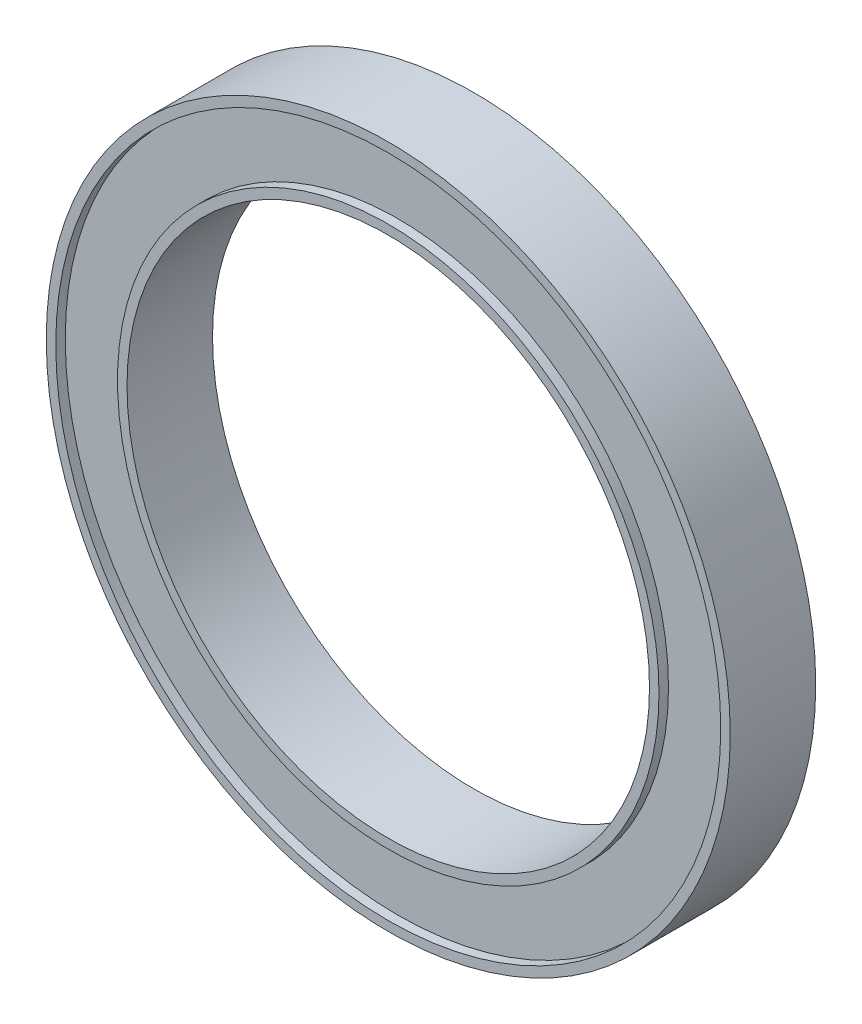
from build123d import *

# Parameters (mm, degrees)
SKETCH_1_R          = 36
EXTRUDE_1_DEPTH     = 9
SKETCH_2_R          = 27.5
CUT_EXTRUDE_1_DEPTH = 52.701063819
SKETCH_3_R          = 35
SKETCH_3_R_2        = 28.5
CUT_EXTRUDE_2_DEPTH = 1
CUT_EXTRUDE_START   = -1
SKETCH_4_R          = 35
SKETCH_4_R_2        = 28.5
CUT_EXTRUDE_3_DEPTH = 1


with BuildPart() as part:
    # 草图1 → 凸台-拉伸1 (new body)
    with BuildSketch(Plane.XY):
        Circle(SKETCH_1_R)
    extrude(amount=EXTRUDE_1_DEPTH)

    # 草图2 → 切除-拉伸1 (cut, through all)
    with BuildSketch(Plane.XY.offset(9)):
        Circle(SKETCH_2_R)
    extrude(amount=-CUT_EXTRUDE_1_DEPTH, mode=Mode.SUBTRACT)

    # 草图3 → 切除-拉伸2 (cut)
    with BuildSketch(Plane.XY.offset(9)):
        Circle(SKETCH_3_R)
        Circle(SKETCH_3_R_2, mode=Mode.SUBTRACT)
    extrude(amount=-CUT_EXTRUDE_2_DEPTH, mode=Mode.SUBTRACT)

    # 草图4 → 切除-拉伸3 (cut)
    with BuildSketch(Plane(origin=(0, 0, 0), x_dir=(-1, 0, 0), z_dir=(0, 0, -1)).offset(CUT_EXTRUDE_START)):
        with Locations(Location((0, 0, 0), (0, 0, 180))):
            Circle(SKETCH_4_R)
        with Locations(Location((0, 0, 0), (0, 0, 180))):
            Circle(SKETCH_4_R_2, mode=Mode.SUBTRACT)
    extrude(amount=CUT_EXTRUDE_3_DEPTH, mode=Mode.SUBTRACT)


solid = part.part
